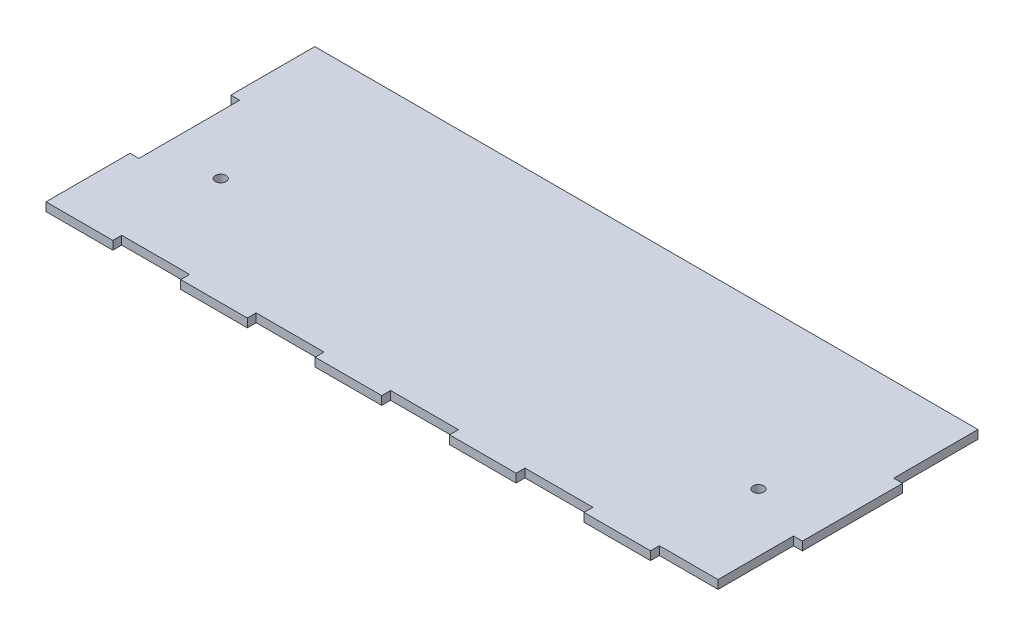
from build123d import *

# Parameters (mm, degrees)
SKETCH1_W           = 500
SKETCH1_H           = 200
BOSS_EXTRUDE1_DEPTH = 3.175
SKETCH2_W           = 50.5
SKETCH2_H           = 6.6
CUT_EXTRUDE1_DEPTH  = 270.333106951
LPATTERN1_COUNT     = 5
LPATTERN1_PITCH     = 100
SKETCH3_W           = 6.6
SKETCH3_H           = 56.15
SKETCH3_H_2         = 62.75
SKETCH3_H_3         = 75
CUT_EXTRUDE2_DEPTH  = 270.333106951
SKETCH4_R           = 4
AXLE_HOLES_DEPTH    = 270.333106951


with BuildPart() as part:
    # Sketch1 → Boss-Extrude1 (new, symmetric)
    with BuildSketch(Plane(origin=(0, 0, 0), x_dir=(1, 0, 0), z_dir=(0, 1, 0))):
        Rectangle(SKETCH1_W, SKETCH1_H)
    extrude(amount=BOSS_EXTRUDE1_DEPTH, both=True)

    # Sketch2 → Cut-Extrude1 (cut, through all)
    with BuildSketch(Plane(origin=(0, 3.175, 0), x_dir=(1, 0, 0), z_dir=(0, 1, 0))):
        with Locations((-175, -96.7)):
            Rectangle(SKETCH2_W, SKETCH2_H)
    cut_extrude1 = extrude(amount=-CUT_EXTRUDE1_DEPTH, mode=Mode.SUBTRACT)

    # LPattern1: Cut-Extrude1 ×5
    with Locations(*[(i * LPATTERN1_PITCH, 0, 0) for i in range(1, LPATTERN1_COUNT)]):
        add(cut_extrude1, mode=Mode.SUBTRACT)

    # Sketch3 → Cut-Extrude2 (cut, through all)
    with BuildSketch(Plane(origin=(0, 3.175, 0), x_dir=(1, 0, 0), z_dir=(0, 1, 0))):
        with Locations((246.7, -65.325)):
            Rectangle(SKETCH3_W, SKETCH3_H)
        with Locations((246.7, 68.625)):
            Rectangle(SKETCH3_W, SKETCH3_H_2)
        with Locations((-246.7, 0)):
            Rectangle(SKETCH3_W, SKETCH3_H_3)
    extrude(amount=-CUT_EXTRUDE2_DEPTH, mode=Mode.SUBTRACT)

    # Sketch4 → Axle Holes (cut, through all)
    with BuildSketch(Plane(origin=(0, 3.175, 0), x_dir=(1, 0, 0), z_dir=(0, 1, 0))):
        with Locations(Location((-200, -20, 0), (0, 0, 270))):
            Circle(SKETCH4_R)
        with Locations(Location((200, -20, 0), (0, 0, 270))):
            Circle(SKETCH4_R)
    extrude(amount=-AXLE_HOLES_DEPTH, mode=Mode.SUBTRACT)


solid = part.part
